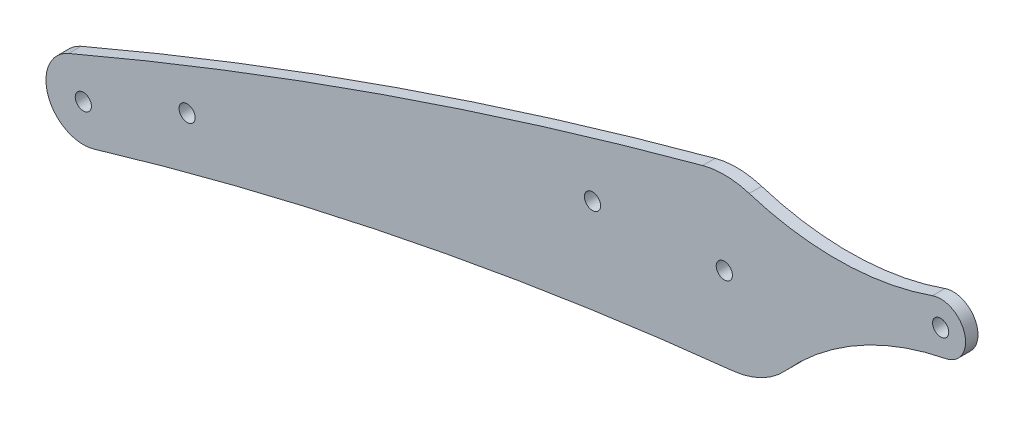
from build123d import *

# Parameters (mm, degrees)
BOSS_EXTRUDE1_DEPTH        = 3
M3_5_CLEARANCE_HOLE1_D     = 3.9
M3_5_CLEARANCE_HOLE1_DEPTH = 10
M3_5_CLEARANCE_HOLE1_TIP   = 1.171678207


with BuildPart() as part:
    # Sketch2 → Boss-Extrude1 (new body)
    with BuildSketch(Plane.XY):
        with BuildLine():
            ThreePointArc((-39.28087001, 224.239774099), (-116.578963105, 200.433975785), (-192.012625607, 171.253951952))
            ThreePointArc((-192.012625607, 171.253951952), (-196.936776164, 159.92081589), (-185.905452535, 154.353309203))
            ThreePointArc((-185.905452535, 154.353309203), (-109.656081484, 173.256403098), (-31.987185034, 185.039274932))
            ThreePointArc((-31.987185034, 185.039274932), (-25.021326492, 187.094578874), (-19.248708765, 191.50188464))
            ThreePointArc((-19.248708765, 191.50188464), (-1.783402645, 205.460636468), (19.192242873, 213.200530885))
            ThreePointArc((19.192242873, 213.200530885), (23.830874934, 220.662171124), (16.054107446, 224.750553433))
            ThreePointArc((16.054107446, 224.750553433), (-5.954280946, 220.811707047), (-28.081978855, 224.013059218))
            ThreePointArc((-28.081978855, 224.013059218), (-33.665228727, 224.926425674), (-39.28087001, 224.239774099))
        make_face()
    extrude(amount=-BOSS_EXTRUDE1_DEPTH)

    # M3.5 Clearance Hole1
    with Locations(Plane.XY):
        with Locations((-188.472457343, 162.979460507), (-163.472457343, 173.083498563), (-65.820033869, 203.530407358), (-34.070033869, 204.930522774), (18.040784053, 219.089006289)):
            Hole(M3_5_CLEARANCE_HOLE1_D / 2, depth=M3_5_CLEARANCE_HOLE1_DEPTH)
            with Locations((0, 0, -(M3_5_CLEARANCE_HOLE1_DEPTH + M3_5_CLEARANCE_HOLE1_TIP / 2))):  # 118° drill point
                Cone(0, M3_5_CLEARANCE_HOLE1_D / 2, M3_5_CLEARANCE_HOLE1_TIP, mode=Mode.SUBTRACT)


solid = part.part
